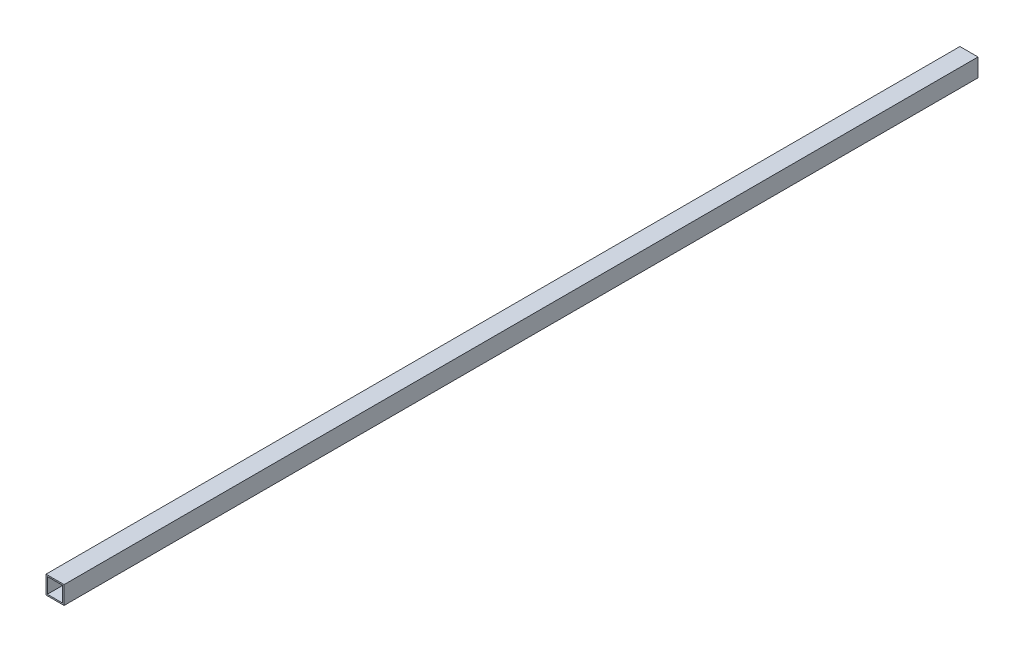
from build123d import *

# Parameters (mm, degrees)
SKETCH_1_W      = 40
SKETCH_1_H      = 40
SKETCH_1_W_2    = 34
SKETCH_1_H_2    = 34
EXTRUDE_1_DEPTH = 2020


with BuildPart() as part:
    # Эскиз1 → Бобышка-Вытянуть1 (new body)
    with BuildSketch(Plane.XY):
        Rectangle(SKETCH_1_W, SKETCH_1_H)
        Rectangle(SKETCH_1_W_2, SKETCH_1_H_2, mode=Mode.SUBTRACT)
    extrude(amount=EXTRUDE_1_DEPTH)


solid = part.part
